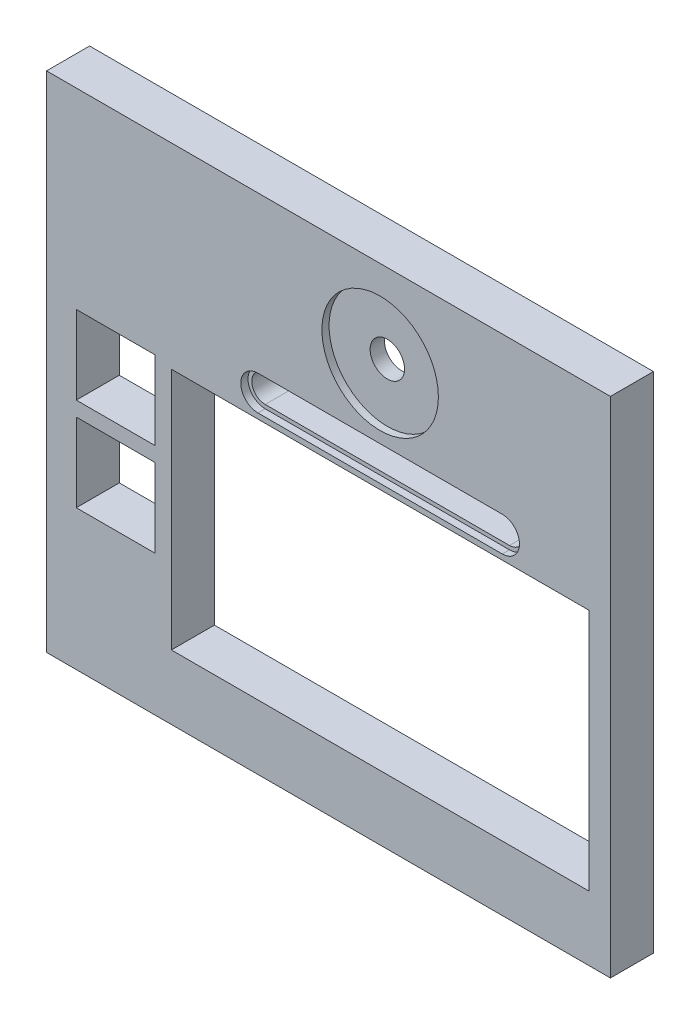
from build123d import *

# Parameters (mm, degrees)
SKETCH1_W                                         = 133.096
SKETCH1_H                                         = 118.890132416
BOSS_EXTRUDE1_DEPTH                               = 10.16
SKETCH1_11_W                                      = 98.552
SKETCH1_11_H                                      = 57.404
SKETCH1_11_W_2                                    = 18.542
SKETCH1_11_H_2                                    = 18.542
SKETCH1_11_R                                      = 4.064
CUT_EXTRUDE1_DEPTH                                = 179.752998302
SKETCH1_12_R                                      = 13.75
SKETCH1_12_R_2                                    = 4.064
CUT_EXTRUDE2_DEPTH                                = 1.7
CSK_FOR_M2_5_FLAT_HEAD_MACHINE_SCREW1_D           = 2.9
CSK_FOR_M2_5_FLAT_HEAD_MACHINE_SCREW1_DEPTH       = 5.08
CSK_FOR_M2_5_FLAT_HEAD_MACHINE_SCREW1_CSINK_D     = 5.5
CSK_FOR_M2_5_FLAT_HEAD_MACHINE_SCREW1_CSINK_ANGLE = 90
CSK_FOR_M2_5_FLAT_HEAD_MACHINE_SCREW1_TIP         = 0.871247898
SKETCH6_R                                         = 4.02
CUT_EXTRUDE3_DEPTH                                = 7.62


with BuildPart() as part:
    # Sketch1 → Boss-Extrude1 (new body)
    with BuildSketch(Plane.XY):
        with Locations((66.548, 59.445066208)):
            Rectangle(SKETCH1_W, SKETCH1_H)
    extrude(amount=-BOSS_EXTRUDE1_DEPTH)

    # Sketch1<11> → Cut-Extrude1 (cut, through all)
    with BuildSketch(Plane.XY):
        with Locations((78.74, 43.942)):
            Rectangle(SKETCH1_11_W, SKETCH1_11_H)
        with Locations((16.289896793, 42.362289183)):
            Rectangle(SKETCH1_11_W_2, SKETCH1_11_H_2)
        with Locations((16.289896793, 64.367970222)):
            Rectangle(SKETCH1_11_W_2, SKETCH1_11_H_2)
        with BuildLine():
            Line((107.569, 81.153), (49.911, 81.153))
            ThreePointArc((49.911, 81.153), (46.736, 77.978), (49.911, 74.803))
            Line((49.911, 74.803), (107.569, 74.803))
            ThreePointArc((107.569, 74.803), (110.744, 77.978), (107.569, 81.153))
        make_face()
        with Locations((78.74, 98.4758)):
            Circle(SKETCH1_11_R)
    extrude(amount=-CUT_EXTRUDE1_DEPTH, mode=Mode.SUBTRACT)

    # Sketch1<12> → Cut-Extrude2 (cut)
    # profile 1 of 2: a face of its own
    with BuildSketch(Plane.XY):
        with BuildLine():
            Line((107.569, 82.042), (49.911, 82.042))
            ThreePointArc((49.911, 82.042), (45.847, 77.978), (49.911, 73.914))
            Line((49.911, 73.914), (107.569, 73.914))
            ThreePointArc((107.569, 73.914), (111.633, 77.978), (107.569, 82.042))
        make_face()
        with BuildLine():
            ThreePointArc((49.911, 74.803), (46.736, 77.978), (49.911, 81.153))
            Line((49.911, 81.153), (107.569, 81.153))
            ThreePointArc((107.569, 81.153), (110.744, 77.978), (107.569, 74.803))
            Line((107.569, 74.803), (49.911, 74.803))
        make_face(mode=Mode.SUBTRACT)
    # profile 2 of 2: a face of its own
    with BuildSketch(Plane.XY):
        with Locations((78.74, 98.4758)):
            Circle(SKETCH1_12_R)
        with Locations((78.74, 98.4758)):
            Circle(SKETCH1_12_R_2, mode=Mode.SUBTRACT)
    extrude(amount=-CUT_EXTRUDE2_DEPTH, mode=Mode.SUBTRACT)

    # CSK for M2.5 Flat Head Machine Screw1
    with Locations(Plane(origin=(0, 0, -10.16), x_dir=(-1, 0, 0), z_dir=(0, 0, -1))):
        with Locations((-109.250378399, 110.932782256), (-65.089376176, 110.932782256), (-6.474944958, 110.932782256), (-16.176873925, 29.217411756)):
            CounterSinkHole(CSK_FOR_M2_5_FLAT_HEAD_MACHINE_SCREW1_D / 2, CSK_FOR_M2_5_FLAT_HEAD_MACHINE_SCREW1_CSINK_D / 2, depth=CSK_FOR_M2_5_FLAT_HEAD_MACHINE_SCREW1_DEPTH, counter_sink_angle=CSK_FOR_M2_5_FLAT_HEAD_MACHINE_SCREW1_CSINK_ANGLE)
            with Locations((0, 0, -(CSK_FOR_M2_5_FLAT_HEAD_MACHINE_SCREW1_DEPTH + CSK_FOR_M2_5_FLAT_HEAD_MACHINE_SCREW1_TIP / 2))):  # 118° drill point
                Cone(0, CSK_FOR_M2_5_FLAT_HEAD_MACHINE_SCREW1_D / 2, CSK_FOR_M2_5_FLAT_HEAD_MACHINE_SCREW1_TIP, mode=Mode.SUBTRACT)

    # Sketch6 → Cut-Extrude3 (cut)
    # profile 1 of 2: a face of its own
    with BuildSketch(Plane(origin=(0, 0, -12.7), x_dir=(-1, 0, 0), z_dir=(0, 0, -1))):
        with BuildLine():
            Line((-130.556, 116.350132416), (-2.54, 116.350132416))
            Line((-2.54, 116.350132416), (-2.54, 111.755344215))
            ThreePointArc((-2.54, 111.755344215), (-10.494944958, 110.932782256), (-2.54, 110.110220296))
            Line((-2.54, 110.110220296), (-2.54, 75.184))
            Line((-2.54, 75.184), (-46.453892972, 75.184))
            ThreePointArc((-46.453892972, 75.184), (-45.899930629, 79.893554097), (-49.911, 82.423))
            Line((-49.911, 82.423), (-107.569, 82.423))
            ThreePointArc((-107.569, 82.423), (-111.580069371, 79.893554097), (-111.026107028, 75.184))
            Line((-111.026107028, 75.184), (-130.556, 75.184))
            Line((-130.556, 75.184), (-130.556, 116.350132416))
        make_face()
        with Locations((-109.250378399, 110.932782256)):
            Circle(SKETCH6_R, mode=Mode.SUBTRACT)
        with Locations((-65.089376176, 110.932782256)):
            Circle(SKETCH6_R, mode=Mode.SUBTRACT)
    # profile 2 of 2: a face of its own
    with BuildSketch(Plane(origin=(0, 0, -12.7), x_dir=(-1, 0, 0), z_dir=(0, 0, -1))):
        with BuildLine():
            Line((-26.924, 30.551289183), (-26.924, 2.54))
            Line((-26.924, 2.54), (-2.54, 2.54))
            Line((-2.54, 2.54), (-2.54, 30.551289183))
            Line((-2.54, 30.551289183), (-12.384622481, 30.551289183))
            ThreePointArc((-12.384622481, 30.551289183), (-16.176873925, 25.197411756), (-19.969125368, 30.551289183))
            Line((-19.969125368, 30.551289183), (-26.924, 30.551289183))
        make_face()
    extrude(amount=-CUT_EXTRUDE3_DEPTH, mode=Mode.SUBTRACT)


solid = part.part
